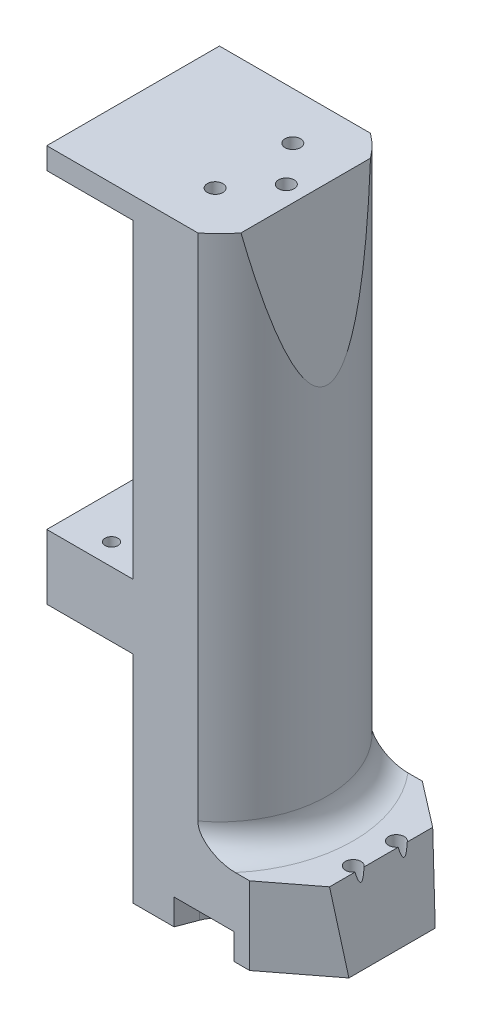
from build123d import *

# Parameters (mm, degrees)
BOSS_EXTRUDE1_DEPTH = 25.4
SKETCH2_R           = 2.286
CUT_EXTRUDE1_DEPTH  = 190.072249682
SKETCH3_R           = 1.905
CUT_EXTRUDE2_DEPTH  = 20.32
SKETCH4_R           = 34.29
CUT_EXTRUDE3_DEPTH  = 63.5
CUT_EXTRUDE4_DEPTH  = 7.62
CUT_EXTRUDE5_DEPTH  = 190.072249682
CUT_EXTRUDE6_DEPTH  = 157.48
FILLET1_R           = 7.62


with BuildPart() as part:
    # Sketch1 → Boss-Extrude1 (new, symmetric)
    with BuildSketch(Plane.XY):
        Polygon((0, 0), (0, 63.5), (-25.4, 63.5), (-25.4, 82.55), (0, 82.55), (0, 173.99), (-25.4, 173.99), (-25.4, 180.34), (25.4, 180.34), (50.8, 0), align=None)
    extrude(amount=BOSS_EXTRUDE1_DEPTH, both=True)

    # Sketch2 → Cut-Extrude1 (cut, through all)
    with BuildSketch(Plane.XZ):
        with Locations((10.16, -11.43)):
            Circle(SKETCH2_R)
        with Locations((19.685, 0)):
            Circle(SKETCH2_R)
        with Locations((10.16, 11.43)):
            Circle(SKETCH2_R)
        with Locations((45.72, -6.35)):
            Circle(SKETCH2_R)
        with Locations((45.72, 6.35)):
            Circle(SKETCH2_R)
    extrude(amount=-CUT_EXTRUDE1_DEPTH, mode=Mode.SUBTRACT)

    # Sketch3 → Cut-Extrude2 (cut)
    with BuildSketch(Plane.XZ.offset(-63.5)):
        with Locations(Location((-12.7, -19.05, 0), (0, 0, 270))):
            Circle(SKETCH3_R)
        with Locations(Location((-12.7, 19.05, 0), (0, 0, 270))):
            Circle(SKETCH3_R)
    extrude(amount=-CUT_EXTRUDE2_DEPTH, mode=Mode.SUBTRACT)

    # Sketch4 → Cut-Extrude3 (cut)
    with BuildSketch(Plane.XZ):
        with Locations((-31.75, 0)):
            Circle(SKETCH4_R)
    extrude(amount=-CUT_EXTRUDE3_DEPTH, mode=Mode.SUBTRACT)

    # Sketch5 → Cut-Extrude4 (cut)
    with BuildSketch(Plane.XZ):
        with BuildLine():
            Line((29.567845881, -25.773285055), (18.829761526, -54.242627064))
            ThreePointArc((18.829761526, -54.242627064), (8.19263059, -59.053187889), (3.382069764, -48.416056953))
            Line((3.382069764, -48.416056953), (14.120154119, -19.946714945))
            ThreePointArc((14.120154119, -19.946714945), (24.757285055, -15.136154119), (29.567845881, -25.773285055))
        make_face()
        with BuildLine():
            Line((29.567845881, 25.773285055), (18.829761526, 54.242627064))
            ThreePointArc((18.829761526, 54.242627064), (8.19263059, 59.053187889), (3.382069764, 48.416056953))
            Line((3.382069764, 48.416056953), (14.120154119, 19.946714945))
            ThreePointArc((14.120154119, 19.946714945), (24.757285055, 15.136154119), (29.567845881, 25.773285055))
        make_face()
    extrude(amount=-CUT_EXTRUDE4_DEPTH, mode=Mode.SUBTRACT)

    # Sketch6 → Cut-Extrude5 (cut, through all)
    with BuildSketch(Plane.XZ):
        Polygon((50.8, 25.4), (50.8, 12.7), (34.29, 25.4), align=None)
        Polygon((34.29, -25.4), (50.8, -25.4), (50.8, -12.7), align=None)
    extrude(amount=-CUT_EXTRUDE5_DEPTH, mode=Mode.SUBTRACT)

    # Sketch7 → Cut-Extrude6 (cut)
    with BuildSketch(Plane(origin=(0, 180.34, 0), x_dir=(1, 0, 0), z_dir=(0, 1, 0))):
        with BuildLine():
            Line((0, 31.75), (50.8, 31.75))
            Line((50.8, 31.75), (50.8, -31.75))
            Line((50.8, -31.75), (0, -31.75))
            ThreePointArc((0, -31.75), (31.75, 0), (0, 31.75))
        make_face()
    extrude(amount=-CUT_EXTRUDE6_DEPTH, mode=Mode.SUBTRACT)

    # Fillet1
    fillet1_edges = [part.edges().sort_by_distance(p)[0] for p in [
        (31.75, 22.86, 0),
    ]]
    fillet(fillet1_edges, radius=FILLET1_R)


solid = part.part
